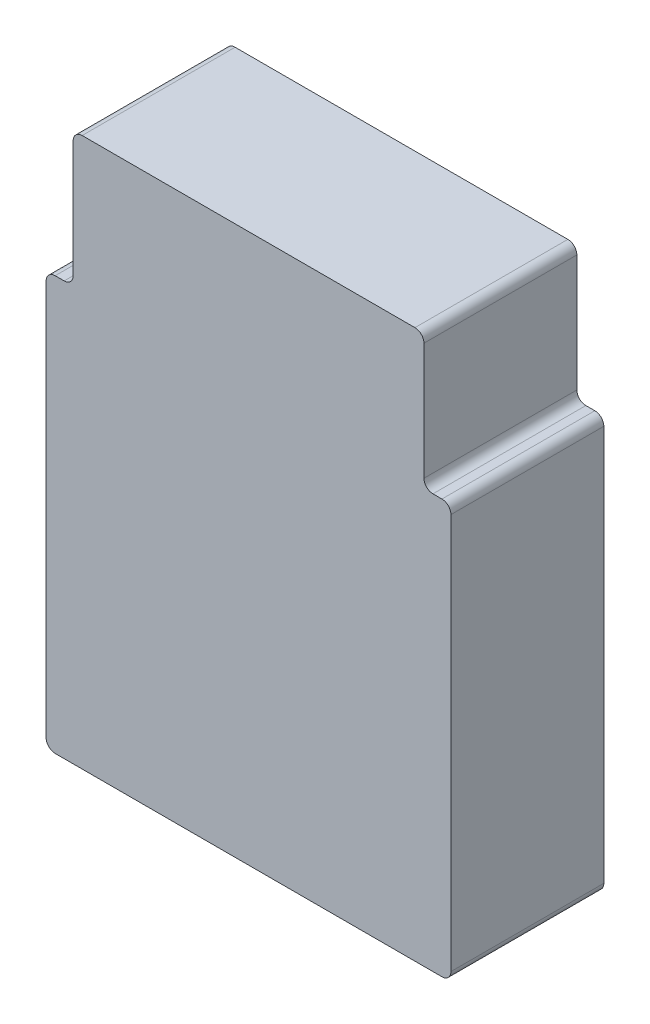
from build123d import *

# Parameters (mm, degrees)
SKETCH_1_W      = 3.9
SKETCH_1_H      = 1.5
EXTRUDE_1_DEPTH = 0.85
FILLET_1_R      = 0.1


with BuildPart() as part:
    # 草图1 → 凸台-拉伸1 (new, symmetric)
    with BuildSketch(Plane.XY):
        Rectangle(SKETCH_1_W, SKETCH_1_H)
        Polygon((1.95, -0.75), (-1.95, -0.75), (-2.25, -0.75), (-2.25, -5.35), (2.25, -5.35), (2.25, -0.75), align=None)
    extrude(amount=EXTRUDE_1_DEPTH, both=True)

    # 圆角1
    fillet_1_edges = [part.edges().sort_by_distance(p)[0] for p in [
        (1.95, -0.75, 0),
        (2.25, -0.75, 0),
        (2.25, -5.35, 0),
        (-2.25, -5.35, 0),
        (-2.25, -0.75, 0),
        (-1.95, -0.75, 0),
        (-1.95, 0.75, 0),
        (1.95, 0.75, 0),
    ]]
    fillet(fillet_1_edges, radius=FILLET_1_R)


solid = part.part
